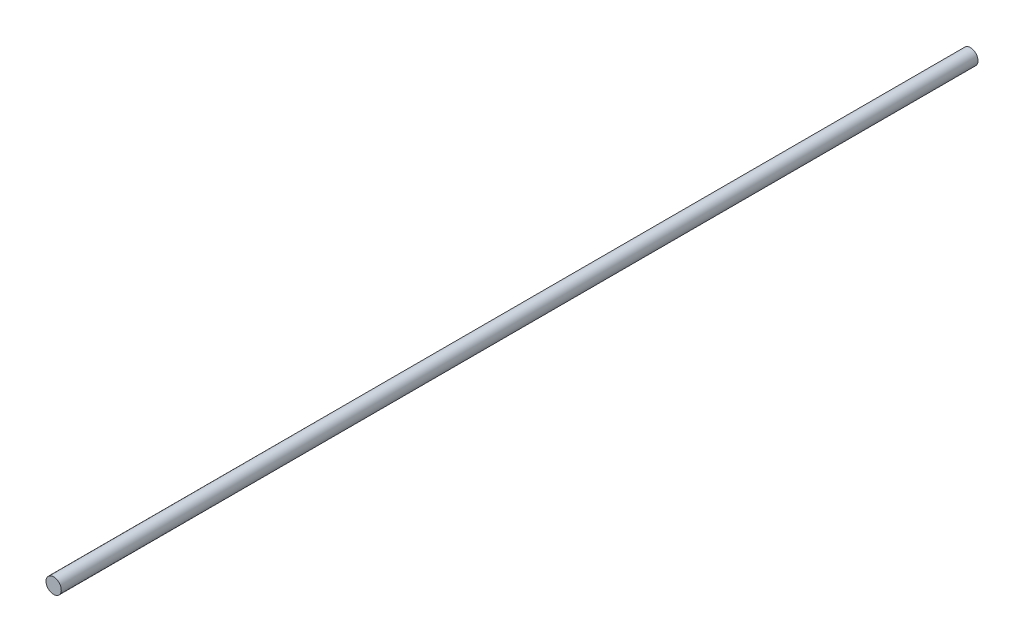
from build123d import *

# Parameters (mm, degrees)
SKETCH1_R           = 6.35
BOSS_EXTRUDE1_DEPTH = 381


with BuildPart() as part:
    # Sketch1 → Boss-Extrude1 (new, symmetric)
    with BuildSketch(Plane.XY):
        Circle(SKETCH1_R)
    extrude(amount=BOSS_EXTRUDE1_DEPTH, both=True)


solid = part.part
